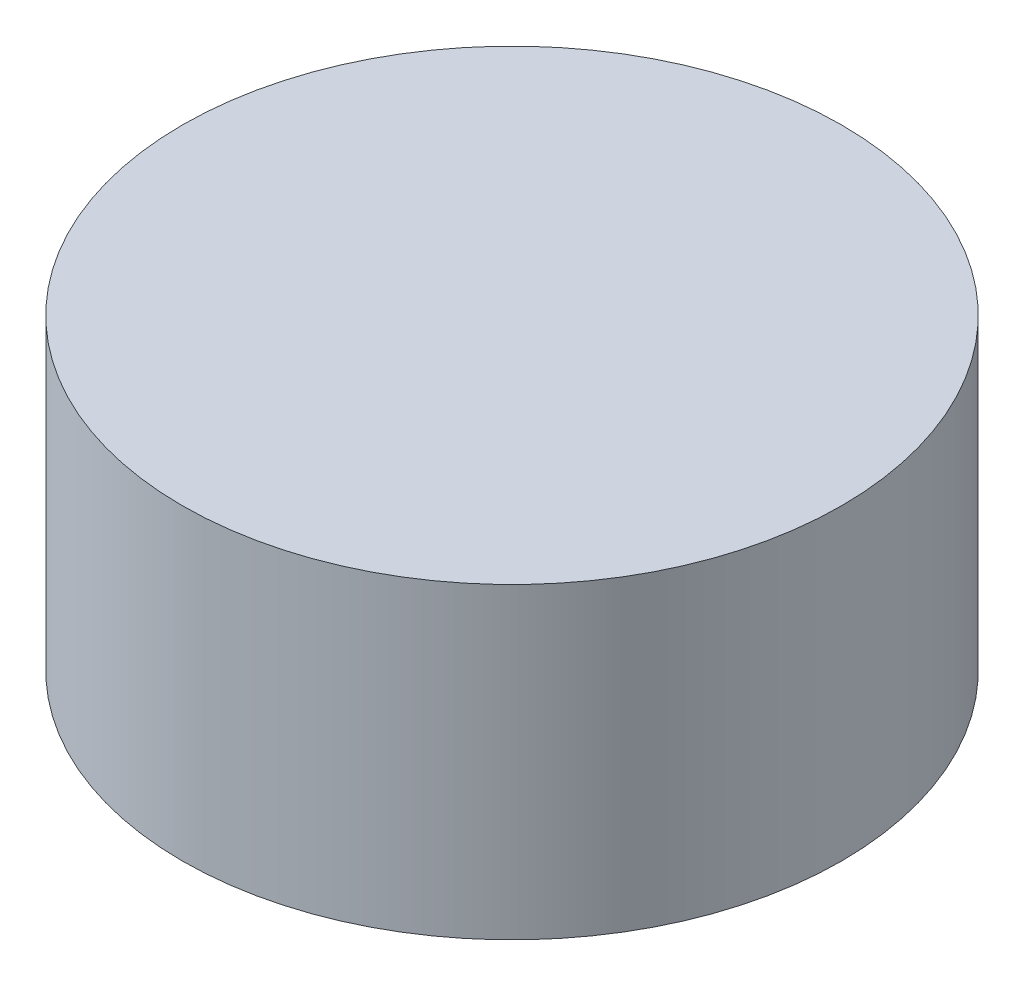
from build123d import *

# Parameters (mm, degrees)
SKETCH_1_R      = 75
EXTRUDE_1_DEPTH = 70


with BuildPart() as part:
    # 草图1 → 凸台-拉伸1 (new body)
    with BuildSketch(Plane(origin=(0, 0, 0), x_dir=(1, 0, 0), z_dir=(0, 1, 0))):
        with Locations(Location((0, 0, 0), (0, 0, 270))):
            Circle(SKETCH_1_R)
    extrude(amount=EXTRUDE_1_DEPTH)


solid = part.part
